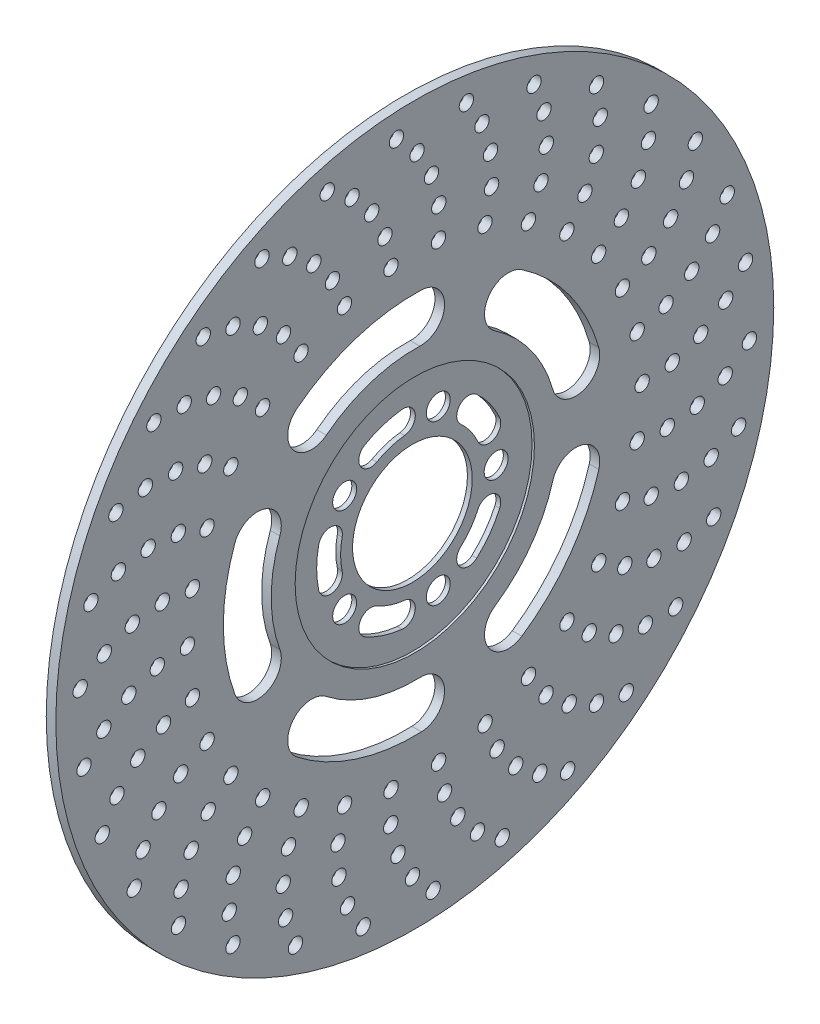
from build123d import *

# Parameters (mm, degrees)
SKETCH1_R           = 150
SKETCH1_R_2         = 50
BOSS_EXTRUDE1_DEPTH = 2
SKETCH1_3_R         = 50
SKETCH1_3_R_2       = 25
BOSS_EXTRUDE2_DEPTH = 1
SKETCH1_4_R         = 5
CUT_EXTRUDE1_DEPTH  = 213.141462237
CIRPATTERN1_COUNT   = 5
SKETCH2_R           = 3
CUT_EXTRUDE2_DEPTH  = 213.169743366
CIRPATTERN2_COUNT   = 30
CUT_EXTRUDE3_DEPTH  = 213.141462237
CIRPATTERN3_COUNT   = 5


with BuildPart() as part:
    # Sketch1 → Boss-Extrude1 (new, symmetric)
    with BuildSketch(Plane.YZ):
        Circle(SKETCH1_R)
        Circle(SKETCH1_R_2, mode=Mode.SUBTRACT)
    extrude(amount=BOSS_EXTRUDE1_DEPTH, both=True)

    # Sketch1<3> → Boss-Extrude2 (add, symmetric)
    with BuildSketch(Plane.YZ):
        Circle(SKETCH1_3_R)
        Circle(SKETCH1_3_R_2, mode=Mode.SUBTRACT)
    extrude(amount=BOSS_EXTRUDE2_DEPTH, both=True)

    # Sketch1<4> → Cut-Extrude1 (cut, symmetric)
    with BuildSketch(Plane.YZ):
        with Locations((0, -35)):
            Circle(SKETCH1_4_R)
        with BuildLine():
            ThreePointArc((-6.128110462, 29.367435403), (0, 30), (6.128110462, 29.367435403))
            ThreePointArc((6.128110462, 29.367435403), (12.044034772, 33.240656227), (8.170813949, 39.156580538))
            ThreePointArc((8.170813949, 39.156580538), (0, 40), (-8.170813949, 39.156580538))
            ThreePointArc((-8.170813949, 39.156580538), (-12.044034772, 33.240656227), (-6.128110462, 29.367435403))
        make_face()
    cut_extrude1 = extrude(amount=CUT_EXTRUDE1_DEPTH, both=True, mode=Mode.SUBTRACT)

    # CirPattern1: Cut-Extrude1 ×5 about axis
    cirpattern1_axis = Axis((1, 0, 0), (1, 0, 0))
    for i in range(1, CIRPATTERN1_COUNT):
        add(cut_extrude1.rotate(cirpattern1_axis, i * 360 / CIRPATTERN1_COUNT), mode=Mode.SUBTRACT)

    # Sketch2 → Cut-Extrude2 (cut, symmetric)
    with BuildSketch(Plane.YZ.offset(2)):
        with Locations((-0.026749619, 94.999996234)):
            Circle(SKETCH2_R)
        with Locations((-22.241290169, 138.222013484)):
            Circle(SKETCH2_R)
        with Locations((-12.690971495, 129.922489131)):
            Circle(SKETCH2_R)
        with Locations((-5.529784086, 119.491377676)):
            Circle(SKETCH2_R)
        with Locations((-1.21630372, 107.596648659)):
            Circle(SKETCH2_R)
    cut_extrude2 = extrude(amount=CUT_EXTRUDE2_DEPTH, both=True, mode=Mode.SUBTRACT)

    # CirPattern2: Cut-Extrude2 ×30 about axis
    cirpattern2_axis = Axis((2, 0, 0), (1, 0, 0))
    for i in range(1, CIRPATTERN2_COUNT):
        add(cut_extrude2.rotate(cirpattern2_axis, i * 360 / CIRPATTERN2_COUNT), mode=Mode.SUBTRACT)

    # Sketch1<5> → Cut-Extrude3 (cut, symmetric)
    with BuildSketch(Plane.YZ):
        with BuildLine():
            ThreePointArc((-20.5212086, 56.381557247), (0, 60), (20.5212086, 56.381557247))
            ThreePointArc((20.5212086, 56.381557247), (33.338336241, 62.358282022), (27.361611466, 75.175409663))
            ThreePointArc((27.361611466, 75.175409663), (0, 80), (-27.361611466, 75.175409663))
            ThreePointArc((-27.361611466, 75.175409663), (-33.338336241, 62.358282022), (-20.5212086, 56.381557247))
        make_face()
    cut_extrude3 = extrude(amount=CUT_EXTRUDE3_DEPTH, both=True, mode=Mode.SUBTRACT)

    # CirPattern3: Cut-Extrude3 ×5 about axis
    cirpattern3_axis = Axis((1, 0, 0), (1, 0, 0))
    for i in range(1, CIRPATTERN3_COUNT):
        add(cut_extrude3.rotate(cirpattern3_axis, i * 360 / CIRPATTERN3_COUNT), mode=Mode.SUBTRACT)


solid = part.part
